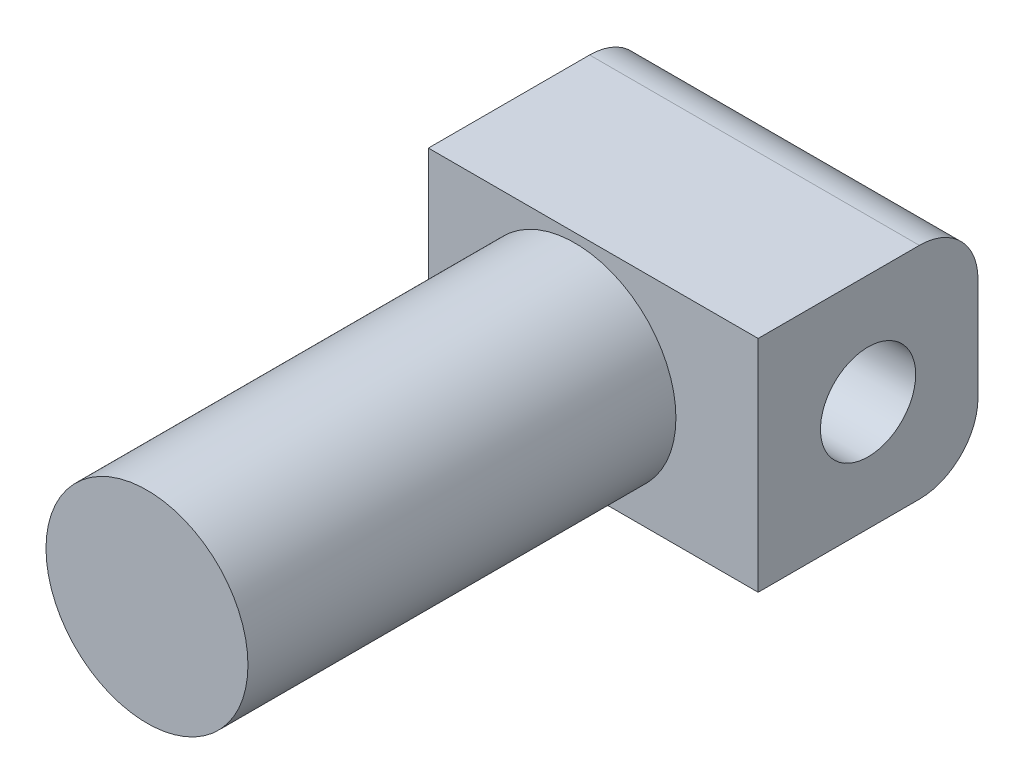
from build123d import *

# Parameters (mm, degrees)
SKETCH1_W                   = 7.62
SKETCH1_H                   = 11.43
BOSS_EXTRUDE1_DEPTH         = 7.62
SKETCH2_R                   = 3.499999985
BOSS_EXTRUDE2_DEPTH         = 14.8336
TAP_DRILL_FOR_M4X0_7_TAP1_D = 3.3
FILLET1_R                   = 2.032


with BuildPart() as part:
    # Sketch1 → Boss-Extrude1 (new body)
    with BuildSketch(Plane(origin=(0, 0, 0), x_dir=(0, 1, 0), z_dir=(0, 0, 1))):
        with Locations((-3.81, 5.715)):
            Rectangle(SKETCH1_W, SKETCH1_H)
    extrude(amount=BOSS_EXTRUDE1_DEPTH)

    # Sketch2 → Boss-Extrude2 (add)
    with BuildSketch(Plane.XY.offset(7.62)):
        with Locations((-6.35, -3.81)):
            Circle(SKETCH2_R)
    extrude(amount=BOSS_EXTRUDE2_DEPTH)

    # Tap Drill for M4x0.7 Tap1 (through all)
    with Locations(Plane(origin=(0, 0, 0), x_dir=(0, 0, -1), z_dir=(1, 0, 0))):
        with Locations((-3.81, -3.81)):
            Hole(TAP_DRILL_FOR_M4X0_7_TAP1_D / 2)

    # Fillet1
    fillet1_edges = [part.edges().sort_by_distance(p)[0] for p in [
        (-5.715, -7.62, 0),
        (-5.715, 0, 0),
    ]]
    fillet(fillet1_edges, radius=FILLET1_R)


solid = part.part
